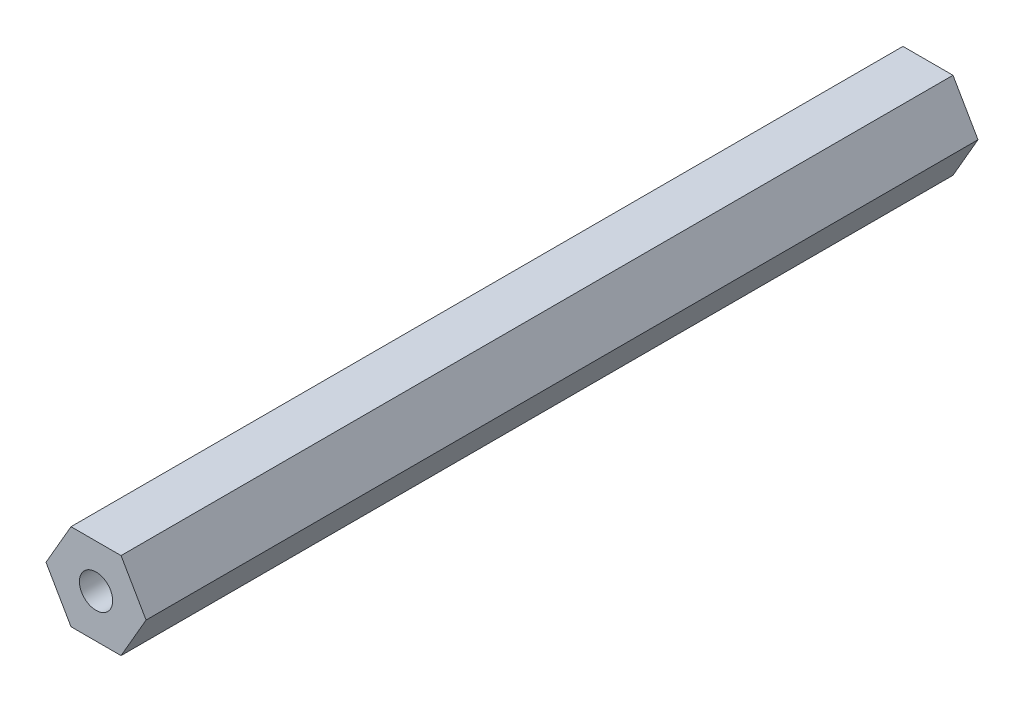
from build123d import *

# Parameters (mm, degrees)
BOSS_EXTRUDE1_DEPTH = 76.2
SKETCH2_R           = 1.524
CUT_EXTRUDE1_DEPTH  = 19.05
CUT_EXTRUDE2_START  = -19.05
SKETCH3_R           = 1.524
CUT_EXTRUDE2_DEPTH  = 19.05
SKETCH6_W           = 2.291358881
SKETCH6_H           = 1.5
CUT_EXTRUDE4_DEPTH  = 19.05


with BuildPart() as part:
    # Sketch1 → Boss-Extrude1 (new body)
    with BuildSketch(Plane.XY):
        Polygon((-117.870682238, 0), (-120.162041119, 3.96875), (-124.744758881, 3.96875), (-127.036117762, 0), (-124.744758881, -3.96875), (-120.162041119, -3.96875), align=None)
    extrude(amount=BOSS_EXTRUDE1_DEPTH)

    # Sketch2 → Cut-Extrude1 (cut)
    with BuildSketch(Plane.XY.offset(76.2)):
        with Locations((-122.4534, 0)):
            Circle(SKETCH2_R)
    extrude(amount=-CUT_EXTRUDE1_DEPTH, mode=Mode.SUBTRACT)

    # Sketch3 → Cut-Extrude2 (cut)
    with BuildSketch(Plane(origin=(0, 0, 0), x_dir=(-1, 0, 0), z_dir=(0, 0, -1)).offset(CUT_EXTRUDE2_START)):
        with Locations(Location((122.4534, 0, 0), (0, 0, 180))):
            Circle(SKETCH3_R)
    extrude(amount=CUT_EXTRUDE2_DEPTH, mode=Mode.SUBTRACT)

    # Sketch6 → Cut-Extrude4 (cut)
    with BuildSketch(Plane.XZ.offset(3.96875)):
        with Locations((-125.890438321, 5.08)):
            Rectangle(SKETCH6_W, SKETCH6_H)
        with Locations((-125.890438321, 10.16)):
            Rectangle(SKETCH6_W, SKETCH6_H)
        with Locations((-125.890438321, 15.24)):
            Rectangle(SKETCH6_W, SKETCH6_H)
        with Locations((-125.890438321, 20.32)):
            Rectangle(SKETCH6_W, SKETCH6_H)
        with Locations((-125.890438321, 25.4)):
            Rectangle(SKETCH6_W, SKETCH6_H)
        with Locations((-125.890438321, 30.48)):
            Rectangle(SKETCH6_W, SKETCH6_H)
        with Locations((-125.890438321, 35.56)):
            Rectangle(SKETCH6_W, SKETCH6_H)
        with Locations((-125.890438321, 40.64)):
            Rectangle(SKETCH6_W, SKETCH6_H)
        with Locations((-125.890438321, 45.72)):
            Rectangle(SKETCH6_W, SKETCH6_H)
        with Locations((-125.890438321, 50.8)):
            Rectangle(SKETCH6_W, SKETCH6_H)
        with Locations((-125.890438321, 55.88)):
            Rectangle(SKETCH6_W, SKETCH6_H)
        with Locations((-125.890438321, 60.96)):
            Rectangle(SKETCH6_W, SKETCH6_H)
        with Locations((-125.890438321, 66.04)):
            Rectangle(SKETCH6_W, SKETCH6_H)
        with Locations((-125.890438321, 71.12)):
            Rectangle(SKETCH6_W, SKETCH6_H)
    extrude(amount=-CUT_EXTRUDE4_DEPTH, mode=Mode.SUBTRACT)


solid = part.part
